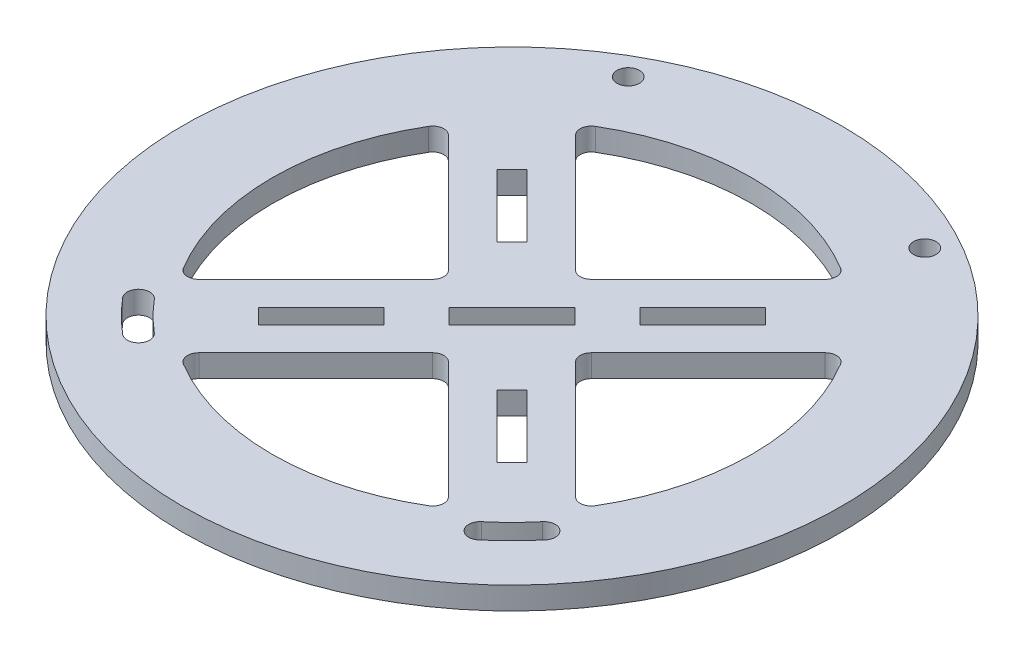
from build123d import *

# Parameters (mm, degrees)
SKETCH1_R           = 46.575911091
SKETCH1_R_2         = 1.5875
BOSS_EXTRUDE1_DEPTH = 3.175


with BuildPart() as part:
    # Sketch1 → Boss-Extrude1 (new body)
    with BuildSketch(Plane(origin=(0, 0, 0), x_dir=(1, 0, 0), z_dir=(0, 1, 0))):
        with Locations(Location((-1e-09, -8.701819906, 0), (0, 0, 270))):
            Circle(SKETCH1_R)
        with Locations(Location((-21.062340002, 28.785905516, 0), (0, 0, 270))):
            Circle(SKETCH1_R_2, mode=Mode.SUBTRACT)
        with Locations(Location((20.847659998, 28.785905516, 0), (0, 0, 270))):
            Circle(SKETCH1_R_2, mode=Mode.SUBTRACT)
        with BuildLine():
            Line((17.640592508, -35.322668494), (1.122532008, -18.804607993))
            ThreePointArc((1.122532008, -18.804607993), (-8e-09, -18.339640008), (-1.122532023, -18.804607993))
            Line((-1.122532023, -18.804607993), (-17.640592542, -35.322668513))
            ThreePointArc((-17.640592542, -35.322668513), (-18.093334403, -36.641843516), (-17.330191572, -37.809238437))
            ThreePointArc((-17.330191572, -37.809238437), (-1.3e-08, -42.577730996), (17.330191539, -37.809238417))
            ThreePointArc((17.330191539, -37.809238417), (18.09333437, -36.641843496), (17.640592508, -35.322668494))
        make_face(mode=Mode.SUBTRACT)
        Polygon((-18.9752812, 8.136160364), (-16.837980243, 10.27346132), (-7.965487196, 1.400968273), (-10.102788153, -0.736332684), align=None, mode=Mode.SUBTRACT)
        with BuildLine():
            Line((26.620848619, -26.342412348), (10.102788136, -9.824351865))
            ThreePointArc((10.102788136, -9.824351865), (9.637820151, -8.70181985), (10.102788136, -7.579287835))
            Line((10.102788136, -7.579287835), (26.620848586, 8.938772615))
            ThreePointArc((26.620848586, 8.938772615), (27.940023589, 9.391514476), (29.107418509, 8.628371644))
            ThreePointArc((29.107418509, 8.628371644), (33.875911069, -8.70181986), (29.107418545, -26.032011374))
            ThreePointArc((29.107418545, -26.032011374), (27.940023624, -26.795154209), (26.620848619, -26.342412348))
        make_face(mode=Mode.SUBTRACT)
        with BuildLine():
            Line((-26.620848661, -26.342412387), (-10.102788145, -9.824351871))
            ThreePointArc((-10.102788145, -9.824351871), (-9.63782016, -8.701819856), (-10.102788145, -7.579287841))
            Line((-10.102788145, -7.579287841), (-26.620848632, 8.938772647))
            ThreePointArc((-26.620848632, 8.938772647), (-27.940023635, 9.391514508), (-29.107418555, 8.628371678))
            ThreePointArc((-29.107418555, 8.628371678), (-33.875911135, -8.701819865), (-29.107418586, -26.032011416))
            ThreePointArc((-29.107418586, -26.032011416), (-27.940023665, -26.795154248), (-26.620848661, -26.342412387))
        make_face(mode=Mode.SUBTRACT)
        Polygon((-18.975281171, -25.539800119), (-10.102788124, -16.667307072), (-7.965487167, -18.804608029), (-16.837980215, -27.677101076), align=None, mode=Mode.SUBTRACT)
        Polygon((-5.504897018, -12.069415894), (3.367596037, -3.196922839), (5.504896994, -5.334223796), (-3.367596061, -14.206716851), align=None, mode=Mode.SUBTRACT)
        Polygon((7.965487156, 1.40096828), (16.837980204, 10.273461327), (18.975281161, 8.13616037), (10.102788113, -0.736332677), align=None, mode=Mode.SUBTRACT)
        Polygon((7.965487164, -18.804608029), (10.102788121, -16.667307072), (18.975281169, -25.539800119), (16.837980212, -27.677101076), align=None, mode=Mode.SUBTRACT)
        with BuildLine():
            Line((-1.122532017, 1.400968288), (-17.640592486, 17.919028757))
            ThreePointArc((-17.640592486, 17.919028757), (-18.093334347, 19.238203762), (-17.330191513, 20.405598683))
            ThreePointArc((-17.330191513, 20.405598683), (-9e-09, 25.174091207), (17.330191488, 20.405598658))
            ThreePointArc((17.330191488, 20.405598658), (18.093334321, 19.238203738), (17.64059246, 17.919028734))
            Line((17.64059246, 17.919028734), (1.122532014, 1.400968288))
            ThreePointArc((1.122532014, 1.400968288), (-1e-09, 0.936000303), (-1.122532017, 1.400968288))
        make_face(mode=Mode.SUBTRACT)
        with BuildLine():
            ThreePointArc((-29.762524278, -33.966511802), (-29.579626476, -31.728910208), (-27.342024882, -31.911808011))
            ThreePointArc((-27.342024882, -31.911808011), (-25.360302369, -34.062122274), (-23.209988106, -36.043844786))
            ThreePointArc((-23.209988106, -36.043844786), (-23.027090304, -38.28144638), (-25.264691898, -38.464344183))
            ThreePointArc((-25.264691898, -38.464344183), (-27.605366399, -36.307186304), (-29.762524278, -33.966511802))
        make_face(mode=Mode.SUBTRACT)
        with BuildLine():
            ThreePointArc((23.000626318, -36.039350311), (22.807915825, -38.276128165), (25.044693679, -38.468838657))
            ThreePointArc((25.044693679, -38.468838657), (27.507381615, -36.209201522), (29.767018749, -33.746513584))
            ThreePointArc((29.767018749, -33.746513584), (29.574308255, -31.509735732), (27.337530403, -31.702446226))
            ThreePointArc((27.337530403, -31.702446226), (25.262317586, -33.964137493), (23.000626318, -36.039350311))
        make_face(mode=Mode.SUBTRACT)
    extrude(amount=BOSS_EXTRUDE1_DEPTH)


solid = part.part
